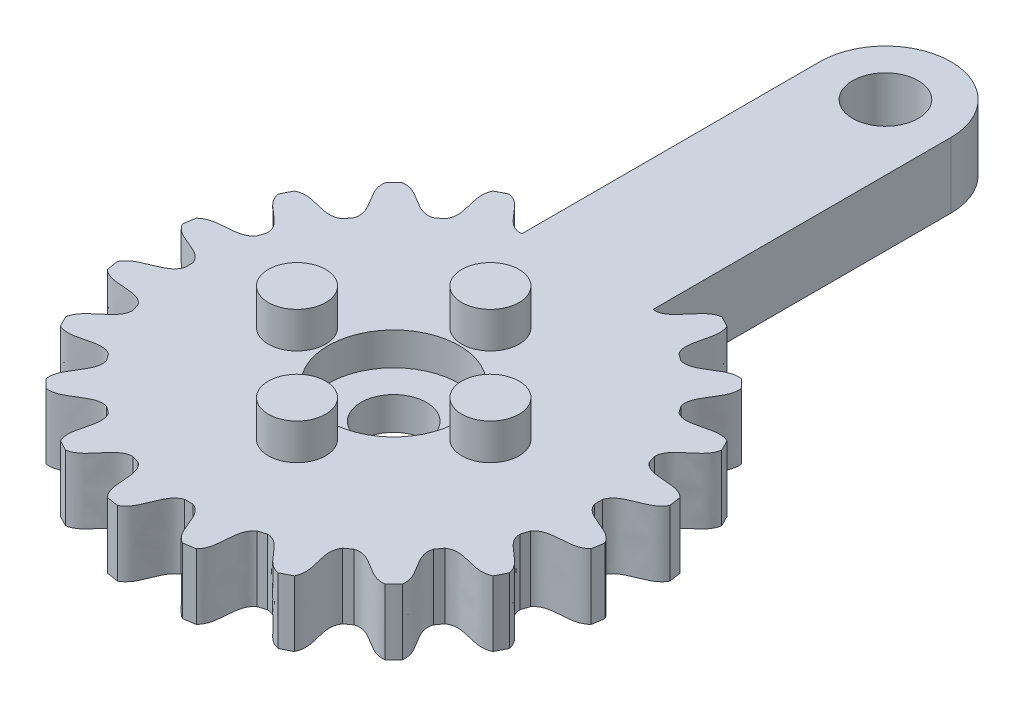
from build123d import *

# Parameters (mm, degrees)
ESQUISSE1_R                  = 15
ESQUISSE1_R_2                = 2
BOSS_EXTRU_1_DEPTH           = 4
ENL_V_MAT_EXTRU_1_DEPTH      = 4
R_P_TITION_CIRCULAIRE1_COUNT = 20
ESQUISSE3_R                  = 2
BOSS_EXTRU_2_DEPTH           = 4
ESQUISSE5_R                  = 1.75
BOSS_EXTRU_3_DEPTH           = 2.2
ESQUISSE6_R                  = 4
ENL_V_MAT_EXTRU_2_DEPTH      = 2


with BuildPart() as part:
    # Esquisse1 → Boss.-Extru.1 (new body)
    with BuildSketch(Plane(origin=(0, 0, 0), x_dir=(1, 0, 0), z_dir=(0, 1, 0))):
        with Locations(Location((0, 0, 0), (0, 0, 270))):
            Circle(ESQUISSE1_R)
        with Locations(Location((0, 0, 0), (0, 0, 270))):
            Circle(ESQUISSE1_R_2, mode=Mode.SUBTRACT)
    extrude(amount=BOSS_EXTRU_1_DEPTH)

    # Esquisse2 → Enlèv. mat.-Extru.1 (cut)
    with BuildSketch(Plane(origin=(0, 4, 0), x_dir=(1, 0, 0), z_dir=(0, 1, 0))):
        with BuildLine():
            Line((0.25, 12.5), (-0.25, 12.5))
            add(Edge.make_bspline(
                [(-0.25, 12.5), (-1.210292611, 12.829221626), (-1.046543714, 14.377393022), (-1.981384064, 14.868561369)],
                knots=[0, 0, 0, 0, 1, 1, 1, 1], degree=3))
            ThreePointArc((-1.981384064, 14.868561369), (0, 15.280808024), (1.981384064, 14.868561369))
            add(Edge.make_bspline(
                [(0.25, 12.5), (1.210292611, 12.829221626), (1.046543714, 14.377393022), (1.981384064, 14.868561369)],
                knots=[0, 0, 0, 0, 1, 1, 1, 1], degree=3))
        make_face()
    enl_v_mat_extru_1 = extrude(amount=-ENL_V_MAT_EXTRU_1_DEPTH, mode=Mode.SUBTRACT)

    # Répétition circulaire1: Enlèv. mat.-Extru.1 ×20 about axis
    r_p_tition_circulaire1_axis = Axis((0, 4, 0), (0, 1, 0))
    for i in range(1, R_P_TITION_CIRCULAIRE1_COUNT):
        add(enl_v_mat_extru_1.rotate(r_p_tition_circulaire1_axis, i * 360 / R_P_TITION_CIRCULAIRE1_COUNT), mode=Mode.SUBTRACT)

    # Esquisse3 → Boss.-Extru.2 (add)
    with BuildSketch(Plane(origin=(0, 4, 0), x_dir=(1, 0, 0), z_dir=(0, 1, 0))):
        with BuildLine():
            Line((4, 6.549364769), (4, 30))
            ThreePointArc((4, 30), (0, 34), (-4, 30))
            Line((-4, 30), (-4, 6.549364769))
            Line((-4, 6.549364769), (4, 6.549364769))
        make_face()
        with Locations(Location((0, 30, 0), (0, 0, 270))):
            Circle(ESQUISSE3_R, mode=Mode.SUBTRACT)
    extrude(amount=-BOSS_EXTRU_2_DEPTH)

    # Esquisse5 → Boss.-Extru.3 (add)
    with BuildSketch(Plane(origin=(0, 4, 0), x_dir=(1, 0, 0), z_dir=(0, 1, 0))):
        with Locations(Location((5.9, 0, 0), (0, 0, 270))):
            Circle(ESQUISSE5_R)
        with Locations(Location((0, -5.9, 0), (0, 0, 270))):
            Circle(ESQUISSE5_R)
        with Locations(Location((-5.9, 0, 0), (0, 0, 270))):
            Circle(ESQUISSE5_R)
        with Locations(Location((0, 5.9, 0), (0, 0, 270))):
            Circle(ESQUISSE5_R)
    extrude(amount=BOSS_EXTRU_3_DEPTH)

    # Esquisse6 → Enlèv. mat.-Extru.2 (cut)
    with BuildSketch(Plane(origin=(0, 4, 0), x_dir=(1, 0, 0), z_dir=(0, 1, 0))):
        with Locations(Location((0, 0, 0), (0, 0, 270))):
            Circle(ESQUISSE6_R)
    extrude(amount=-ENL_V_MAT_EXTRU_2_DEPTH, mode=Mode.SUBTRACT)


solid = part.part
